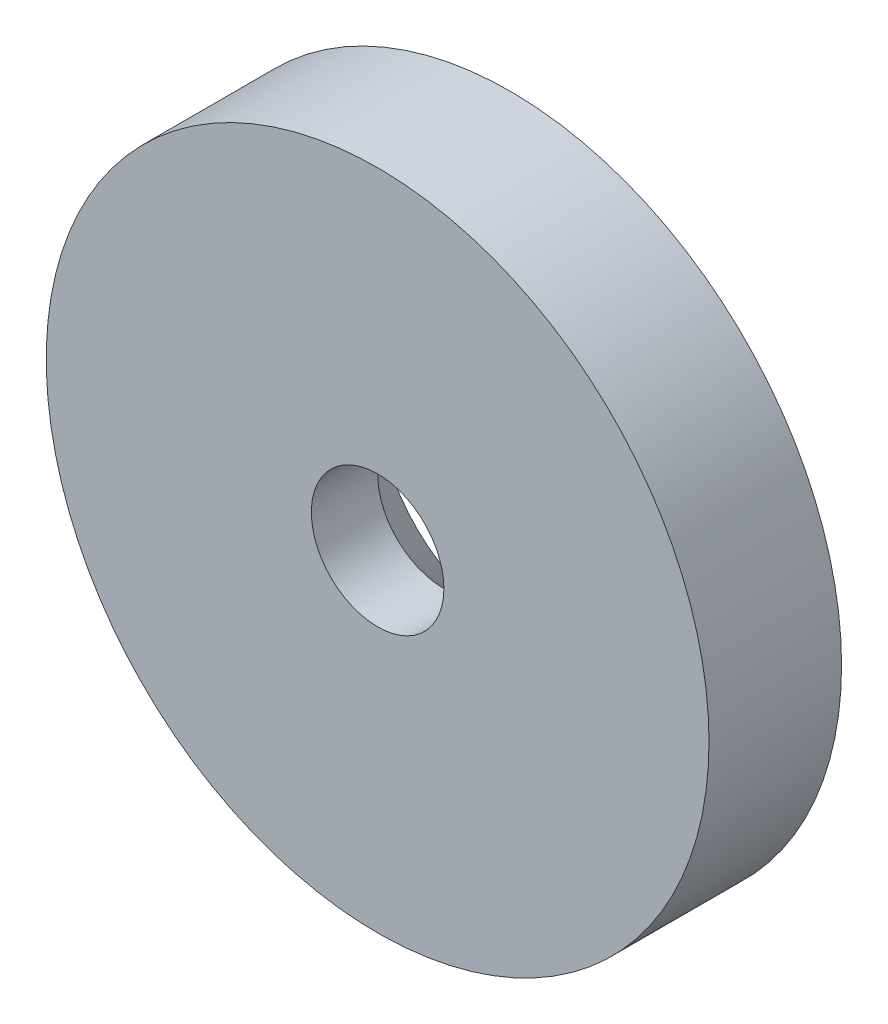
from build123d import *

# Parameters (mm, degrees)
SKETCH_1_R          = 10
EXTRUDE_1_DEPTH     = 4
SKETCH_2_R          = 2
CUT_EXTRUDE_1_DEPTH = 4
CHAMFER_1_SIZE      = 2


with BuildPart() as part:
    # 草图1 → 凸台-拉伸1 (new body)
    with BuildSketch(Plane.XY):
        Circle(SKETCH_1_R)
    extrude(amount=EXTRUDE_1_DEPTH)

    # 草图2 → 切除-拉伸1 (cut)
    with BuildSketch(Plane.XY.offset(4)):
        Circle(SKETCH_2_R)
    extrude(amount=-CUT_EXTRUDE_1_DEPTH, mode=Mode.SUBTRACT)

    # 倒角1
    chamfer_1_edges = [part.edges().sort_by_distance(p)[0] for p in [
        (-2, 0, 0),
    ]]
    chamfer(chamfer_1_edges, length=CHAMFER_1_SIZE)


solid = part.part
